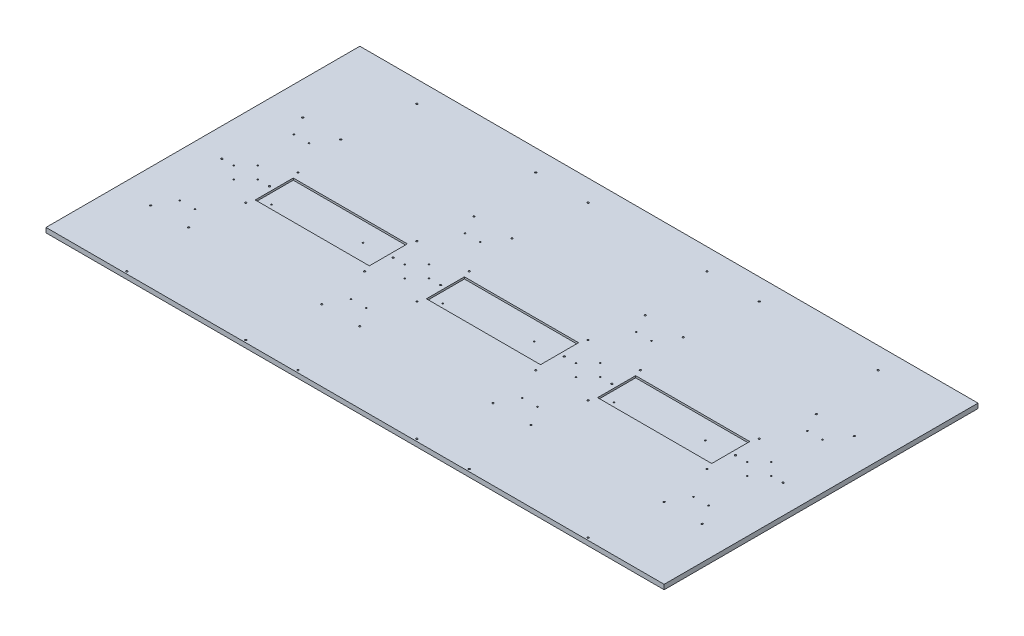
from build123d import *

# Parameters (mm, degrees)
SKETCH1_W               = 800.1
SKETCH1_H               = 419.1
BOSS_EXTRUDE1_DEPTH     = 6.35
SKETCH6_W               = 12.7
SKETCH6_H               = 419.1
BOSS_EXTRUDE2_DEPTH     = 6.35
CUT_EXTRUDE1_DEPTH      = 915.510236411
CUT_EXTRUDE1_DEPTH_BACK = 915.510236411
SKETCH4_R               = 1.1303
SKETCH5_R               = 1.1303
CUT_EXTRUDE2_DEPTH      = 915.510236411
SKETCH7_W               = 152.4
SKETCH7_H               = 50.8
CUT_EXTRUDE3_DEPTH      = 2.54
SKETCH8_R               = 0.889
CUT_EXTRUDE5_DEPTH      = 915.496126892
SKETCH9_R               = 0.889
CUT_EXTRUDE6_DEPTH      = 915.510236411
SKETCH10_R              = 0.889
CUT_EXTRUDE7_DEPTH      = 915.510236411


with BuildPart() as part:
    # Sketch1 → Boss-Extrude1 (new body)
    with BuildSketch(Plane(origin=(0, 0, 0), x_dir=(1, 0, 0), z_dir=(0, 1, 0))):
        with Locations((400.05, 209.55)):
            Rectangle(SKETCH1_W, SKETCH1_H)
    extrude(amount=BOSS_EXTRUDE1_DEPTH)

    # Sketch6 → Boss-Extrude2 (add)
    with BuildSketch(Plane(origin=(0, 6.35, 0), x_dir=(1, 0, 0), z_dir=(0, 1, 0))):
        with Locations((-6.35, 209.55)):
            Rectangle(SKETCH6_W, SKETCH6_H)
        with Locations((806.45, 209.55)):
            Rectangle(SKETCH6_W, SKETCH6_H)
    extrude(amount=-BOSS_EXTRUDE2_DEPTH)

    # Sketch4 → Cut-Extrude1 (cut, two sides: drawn at the far end of the back side and taken through both)
    with BuildSketch(Plane(origin=(0, 6.35, 0), x_dir=(1, 0, 0), z_dir=(0, 1, 0)).offset(-CUT_EXTRUDE1_DEPTH_BACK)):
        with Locations(Location((92.075, 390.525, 0), (0, 0, 270))):
            Circle(SKETCH4_R)
        with Locations(Location((250.825, 231.775, 0), (0, 0, 90))):
            Circle(SKETCH4_R)
        with Locations(Location((250.825, 390.525, 0), (0, 0, 270))):
            Circle(SKETCH4_R)
        with Locations(Location((92.075, 231.775, 0), (0, 0, 90))):
            Circle(SKETCH4_R)
        with Locations(Location((320.675, 390.525, 0), (0, 0, 270))):
            Circle(SKETCH4_R)
        with Locations(Location((320.675, 231.775, 0), (0, 0, 90))):
            Circle(SKETCH4_R)
        with Locations(Location((479.425, 231.775, 0), (0, 0, 90))):
            Circle(SKETCH4_R)
        with Locations(Location((479.425, 390.525, 0), (0, 0, 270))):
            Circle(SKETCH4_R)
        with Locations(Location((549.275, 390.525, 0), (0, 0, 270))):
            Circle(SKETCH4_R)
        with Locations(Location((549.275, 231.775, 0), (0, 0, 90))):
            Circle(SKETCH4_R)
        with Locations(Location((708.025, 231.775, 0), (0, 0, 90))):
            Circle(SKETCH4_R)
        with Locations(Location((708.025, 390.525, 0), (0, 0, 270))):
            Circle(SKETCH4_R)
        with Locations(Location((320.675, 161.925, 0), (0, 0, 270))):
            Circle(SKETCH4_R)
        with Locations(Location((320.675, 3.175, 0), (0, 0, 90))):
            Circle(SKETCH4_R)
        with Locations(Location((479.425, 3.175, 0), (0, 0, 90))):
            Circle(SKETCH4_R)
        with Locations(Location((479.425, 161.925, 0), (0, 0, 270))):
            Circle(SKETCH4_R)
        with Locations(Location((549.275, 161.925, 0), (0, 0, 270))):
            Circle(SKETCH4_R)
        with Locations(Location((549.275, 3.175, 0), (0, 0, 90))):
            Circle(SKETCH4_R)
        with Locations(Location((708.025, 3.175, 0), (0, 0, 90))):
            Circle(SKETCH4_R)
        with Locations(Location((708.025, 161.925, 0), (0, 0, 270))):
            Circle(SKETCH4_R)
        with Locations(Location((92.075, 161.925, 0), (0, 0, 270))):
            Circle(SKETCH4_R)
        with Locations(Location((92.075, 3.175, 0), (0, 0, 90))):
            Circle(SKETCH4_R)
        with Locations(Location((250.825, 3.175, 0), (0, 0, 90))):
            Circle(SKETCH4_R)
        with Locations(Location((250.825, 161.925, 0), (0, 0, 270))):
            Circle(SKETCH4_R)
    extrude(amount=CUT_EXTRUDE1_DEPTH + CUT_EXTRUDE1_DEPTH_BACK, mode=Mode.SUBTRACT)

    # Sketch5 → Cut-Extrude2 (cut, through all)
    with BuildSketch(Plane(origin=(0, 6.35, 0), x_dir=(1, 0, 0), z_dir=(0, 1, 0))):
        with Locations(Location((82.55, 95.25, 0), (0, 0, 270))):
            Circle(SKETCH5_R)
        with Locations(Location((31.75, 95.25, 0), (0, 0, 90))):
            Circle(SKETCH5_R)
        with Locations(Location((82.55, 298.45, 0), (0, 0, 90))):
            Circle(SKETCH5_R)
        with Locations(Location((31.75, 298.45, 0), (0, 0, 270))):
            Circle(SKETCH5_R)
        with Locations(Location((88.9, 196.85, 0), (0, 0, 270))):
            Circle(SKETCH5_R)
        with Locations(Location((25.4, 196.85, 0), (0, 0, 270))):
            Circle(SKETCH5_R)
        with Locations(Location((254, 196.85, 0), (0, 0, 270))):
            Circle(SKETCH5_R)
        with Locations(Location((317.5, 196.85, 0), (0, 0, 270))):
            Circle(SKETCH5_R)
        with Locations(Location((260.35, 95.25, 0), (0, 0, 90))):
            Circle(SKETCH5_R)
        with Locations(Location((311.15, 95.25, 0), (0, 0, 270))):
            Circle(SKETCH5_R)
        with Locations(Location((260.35, 298.45, 0), (0, 0, 270))):
            Circle(SKETCH5_R)
        with Locations(Location((311.15, 298.45, 0), (0, 0, 90))):
            Circle(SKETCH5_R)
        with Locations(Location((482.6, 196.85, 0), (0, 0, 270))):
            Circle(SKETCH5_R)
        with Locations(Location((546.1, 196.85, 0), (0, 0, 270))):
            Circle(SKETCH5_R)
        with Locations(Location((488.95, 95.25, 0), (0, 0, 90))):
            Circle(SKETCH5_R)
        with Locations(Location((539.75, 95.25, 0), (0, 0, 270))):
            Circle(SKETCH5_R)
        with Locations(Location((488.95, 298.45, 0), (0, 0, 270))):
            Circle(SKETCH5_R)
        with Locations(Location((539.75, 298.45, 0), (0, 0, 90))):
            Circle(SKETCH5_R)
        with Locations(Location((711.2, 196.85, 0), (0, 0, 270))):
            Circle(SKETCH5_R)
        with Locations(Location((774.7, 196.85, 0), (0, 0, 270))):
            Circle(SKETCH5_R)
        with Locations(Location((717.55, 95.25, 0), (0, 0, 90))):
            Circle(SKETCH5_R)
        with Locations(Location((768.35, 95.25, 0), (0, 0, 270))):
            Circle(SKETCH5_R)
        with Locations(Location((717.55, 298.45, 0), (0, 0, 270))):
            Circle(SKETCH5_R)
        with Locations(Location((768.35, 298.45, 0), (0, 0, 90))):
            Circle(SKETCH5_R)
    extrude(amount=-CUT_EXTRUDE2_DEPTH, mode=Mode.SUBTRACT)

    # Sketch7 → Cut-Extrude3 (cut)
    with BuildSketch(Plane(origin=(0, 6.35, 0), x_dir=(1, 0, 0), z_dir=(0, 1, 0))):
        with Locations((171.45, 196.85)):
            Rectangle(SKETCH7_W, SKETCH7_H)
        with Locations((400.05, 196.85)):
            Rectangle(SKETCH7_W, SKETCH7_H)
        with Locations((628.65, 196.85)):
            Rectangle(SKETCH7_W, SKETCH7_H)
    extrude(amount=-CUT_EXTRUDE3_DEPTH, mode=Mode.SUBTRACT)

    # Sketch8 → Cut-Extrude5 (cut, through all)
    with BuildSketch(Plane(origin=(0, 3.81, 0), x_dir=(1, 0, 0), z_dir=(0, 1, 0))):
        with Locations(Location((337.768946, 179.451, 0), (0, 0, 270))):
            Circle(SKETCH8_R)
        with Locations(Location((566.368946, 179.451, 0), (0, 0, 270))):
            Circle(SKETCH8_R)
        with Locations(Location((671.449, 196.469, 0), (0, 0, 270))):
            Circle(SKETCH8_R)
        with Locations(Location((214.249, 196.469, 0), (0, 0, 270))):
            Circle(SKETCH8_R)
        with Locations(Location((109.168946, 179.451, 0), (0, 0, 270))):
            Circle(SKETCH8_R)
        with Locations(Location((442.849, 196.469, 0), (0, 0, 270))):
            Circle(SKETCH8_R)
    extrude(amount=-CUT_EXTRUDE5_DEPTH, mode=Mode.SUBTRACT)

    # Sketch9 → Cut-Extrude6 (cut, through all)
    with BuildSketch(Plane(origin=(0, 6.35, 0), x_dir=(1, 0, 0), z_dir=(0, 1, 0))):
        with Locations(Location((40.985567, 196.85, 0), (0, 0, 270))):
            Circle(SKETCH9_R)
        with Locations(Location((57.15, 213.014433, 0), (0, 0, 270))):
            Circle(SKETCH9_R)
        with Locations(Location((73.314433, 196.85, 0), (0, 0, 270))):
            Circle(SKETCH9_R)
        with Locations(Location((57.15, 180.685567, 0), (0, 0, 270))):
            Circle(SKETCH9_R)
        with Locations(Location((269.585567, 196.85, 0), (0, 0, 270))):
            Circle(SKETCH9_R)
        with Locations(Location((285.75, 213.014433, 0), (0, 0, 270))):
            Circle(SKETCH9_R)
        with Locations(Location((301.914433, 196.85, 0), (0, 0, 270))):
            Circle(SKETCH9_R)
        with Locations(Location((285.75, 180.685567, 0), (0, 0, 270))):
            Circle(SKETCH9_R)
        with Locations(Location((498.185567, 196.85, 0), (0, 0, 270))):
            Circle(SKETCH9_R)
        with Locations(Location((514.35, 213.014433, 0), (0, 0, 270))):
            Circle(SKETCH9_R)
        with Locations(Location((530.514433, 196.85, 0), (0, 0, 270))):
            Circle(SKETCH9_R)
        with Locations(Location((514.35, 180.685567, 0), (0, 0, 270))):
            Circle(SKETCH9_R)
        with Locations(Location((726.785567, 196.85, 0), (0, 0, 270))):
            Circle(SKETCH9_R)
        with Locations(Location((742.95, 213.014433, 0), (0, 0, 270))):
            Circle(SKETCH9_R)
        with Locations(Location((759.114433, 196.85, 0), (0, 0, 270))):
            Circle(SKETCH9_R)
        with Locations(Location((742.95, 180.685567, 0), (0, 0, 270))):
            Circle(SKETCH9_R)
    extrude(amount=-CUT_EXTRUDE6_DEPTH, mode=Mode.SUBTRACT)

    # Sketch10 → Cut-Extrude7 (cut, through all)
    with BuildSketch(Plane(origin=(0, 6.35, 0), x_dir=(1, 0, 0), z_dir=(0, 1, 0))):
        with Locations(Location((45.296767183, 273.05, 0), (0, 0, 270))):
            Circle(SKETCH10_R)
        with Locations(Location((65.616767183, 273.05, 0), (0, 0, 90))):
            Circle(SKETCH10_R)
        with Locations(Location((65.616767183, 120.65, 0), (0, 0, 270))):
            Circle(SKETCH10_R)
        with Locations(Location((45.296767183, 120.65, 0), (0, 0, 90))):
            Circle(SKETCH10_R)
        with Locations(Location((273.896767183, 120.65, 0), (0, 0, 90))):
            Circle(SKETCH10_R)
        with Locations(Location((294.216767183, 120.65, 0), (0, 0, 270))):
            Circle(SKETCH10_R)
        with Locations(Location((273.896767183, 273.05, 0), (0, 0, 270))):
            Circle(SKETCH10_R)
        with Locations(Location((294.216767183, 273.05, 0), (0, 0, 90))):
            Circle(SKETCH10_R)
        with Locations(Location((502.496767183, 120.65, 0), (0, 0, 90))):
            Circle(SKETCH10_R)
        with Locations(Location((522.816767183, 120.65, 0), (0, 0, 270))):
            Circle(SKETCH10_R)
        with Locations(Location((502.496767183, 273.05, 0), (0, 0, 270))):
            Circle(SKETCH10_R)
        with Locations(Location((522.816767183, 273.05, 0), (0, 0, 90))):
            Circle(SKETCH10_R)
        with Locations(Location((731.096767183, 120.65, 0), (0, 0, 90))):
            Circle(SKETCH10_R)
        with Locations(Location((751.416767183, 120.65, 0), (0, 0, 270))):
            Circle(SKETCH10_R)
        with Locations(Location((731.096767183, 273.05, 0), (0, 0, 270))):
            Circle(SKETCH10_R)
        with Locations(Location((751.416767183, 273.05, 0), (0, 0, 90))):
            Circle(SKETCH10_R)
    extrude(amount=-CUT_EXTRUDE7_DEPTH, mode=Mode.SUBTRACT)


solid = part.part
